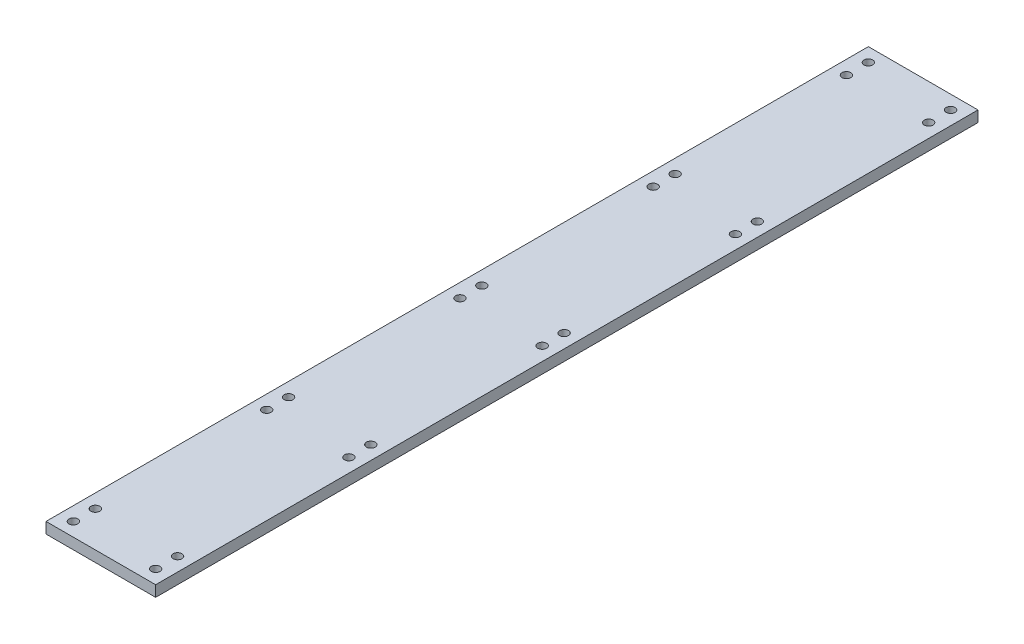
from build123d import *

# Parameters (mm, degrees)
SKETCH_1_W      = 40
SKETCH_1_H      = 300
SKETCH_1_R      = 1.6
EXTRUDE_1_DEPTH = 4


with BuildPart() as part:
    # 草图1 → 凸台-拉伸1 (new body)
    with BuildSketch(Plane(origin=(0, 0, 0), x_dir=(1, 0, 0), z_dir=(0, 1, 0))):
        Rectangle(SKETCH_1_W, SKETCH_1_H)
        with Locations(Location((-15, 145, 0), (0, 0, 270))):
            Circle(SKETCH_1_R, mode=Mode.SUBTRACT)
        with Locations(Location((-15, 137, 0), (0, 0, 270))):
            Circle(SKETCH_1_R, mode=Mode.SUBTRACT)
        with Locations(Location((15, 145, 0), (0, 0, 270))):
            Circle(SKETCH_1_R, mode=Mode.SUBTRACT)
        with Locations(Location((15, 137, 0), (0, 0, 270))):
            Circle(SKETCH_1_R, mode=Mode.SUBTRACT)
        with Locations(Location((15, 74.5, 0), (0, 0, 270))):
            Circle(SKETCH_1_R, mode=Mode.SUBTRACT)
        with Locations(Location((15, 66.5, 0), (0, 0, 270))):
            Circle(SKETCH_1_R, mode=Mode.SUBTRACT)
        with Locations(Location((15, 4, 0), (0, 0, 270))):
            Circle(SKETCH_1_R, mode=Mode.SUBTRACT)
        with Locations(Location((15, -4, 0), (0, 0, 270))):
            Circle(SKETCH_1_R, mode=Mode.SUBTRACT)
        with Locations(Location((15, -66.5, 0), (0, 0, 270))):
            Circle(SKETCH_1_R, mode=Mode.SUBTRACT)
        with Locations(Location((15, -74.5, 0), (0, 0, 270))):
            Circle(SKETCH_1_R, mode=Mode.SUBTRACT)
        with Locations(Location((15, -137, 0), (0, 0, 270))):
            Circle(SKETCH_1_R, mode=Mode.SUBTRACT)
        with Locations(Location((15, -145, 0), (0, 0, 270))):
            Circle(SKETCH_1_R, mode=Mode.SUBTRACT)
        with Locations(Location((-15, 74.5, 0), (0, 0, 270))):
            Circle(SKETCH_1_R, mode=Mode.SUBTRACT)
        with Locations(Location((-15, 66.5, 0), (0, 0, 270))):
            Circle(SKETCH_1_R, mode=Mode.SUBTRACT)
        with Locations(Location((-15, 4, 0), (0, 0, 270))):
            Circle(SKETCH_1_R, mode=Mode.SUBTRACT)
        with Locations(Location((-15, -4, 0), (0, 0, 270))):
            Circle(SKETCH_1_R, mode=Mode.SUBTRACT)
        with Locations(Location((-15, -66.5, 0), (0, 0, 270))):
            Circle(SKETCH_1_R, mode=Mode.SUBTRACT)
        with Locations(Location((-15, -74.5, 0), (0, 0, 270))):
            Circle(SKETCH_1_R, mode=Mode.SUBTRACT)
        with Locations(Location((-15, -137, 0), (0, 0, 270))):
            Circle(SKETCH_1_R, mode=Mode.SUBTRACT)
        with Locations(Location((-15, -145, 0), (0, 0, 270))):
            Circle(SKETCH_1_R, mode=Mode.SUBTRACT)
    extrude(amount=EXTRUDE_1_DEPTH)


solid = part.part
